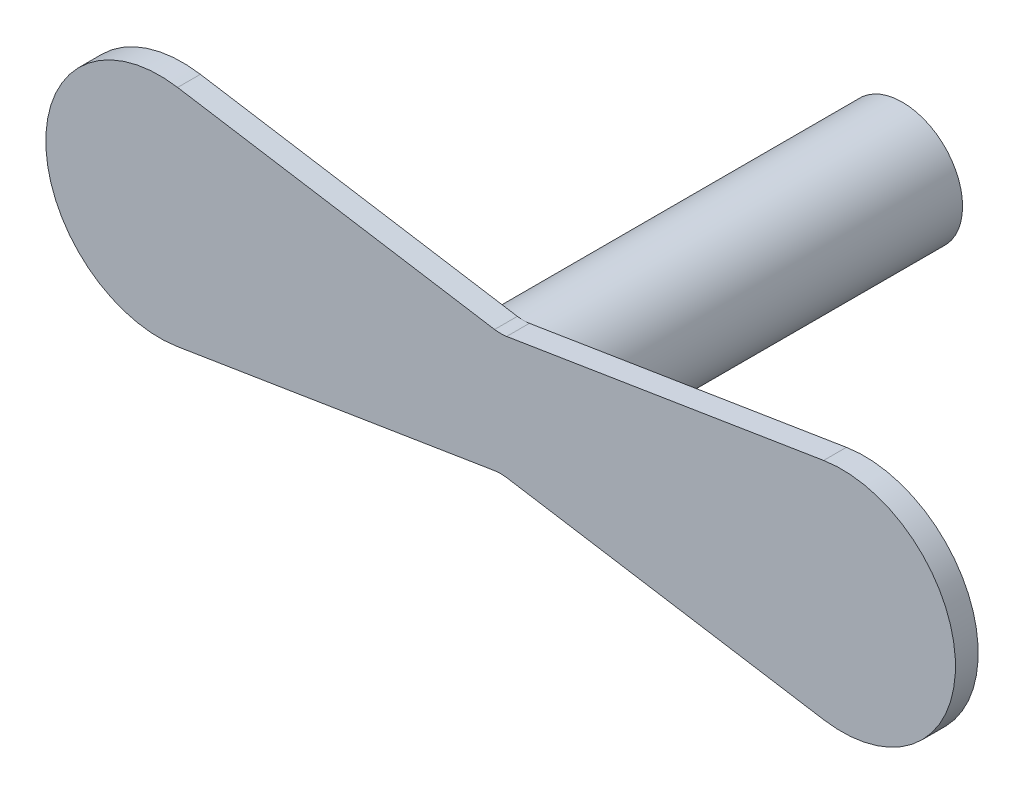
from build123d import *

# Parameters (mm, degrees)
SKETCH1_R           = 7.9375
BOSS_EXTRUDE1_DEPTH = 50
BOSS_EXTRUDE2_DEPTH = 3
FILLET1_R           = 5


with BuildPart() as part:
    # Sketch1 → Boss-Extrude1 (new body)
    with BuildSketch(Plane.XY):
        Circle(SKETCH1_R)
    extrude(amount=BOSS_EXTRUDE1_DEPTH)

    # Sketch2 → Boss-Extrude2 (add)
    with BuildSketch(Plane.XY.offset(50)):
        with BuildLine():
            Line((0, -7.9375), (0, 7.9375))
            Line((0, 7.9375), (42.612091922, 14.808710106))
            ThreePointArc((42.612091922, 14.808710106), (60, 0), (42.612091922, -14.808710106))
            Line((42.612091922, -14.808710106), (0, -7.9375))
        make_face()
    boss_extrude2 = extrude(amount=BOSS_EXTRUDE2_DEPTH)

    # Mirror1: Boss-Extrude2 across plane
    add(boss_extrude2.mirror(Plane(origin=(0, -7.9375, 53), x_dir=(0, 0, 1), z_dir=(1, 0, 0))))

    # Fillet1
    fillet1_edges = [part.edges().sort_by_distance(p)[0] for p in [
        (0, 7.9375, 51.5),
        (0, -7.9375, 51.5),
    ]]
    fillet(fillet1_edges, radius=FILLET1_R)


solid = part.part
